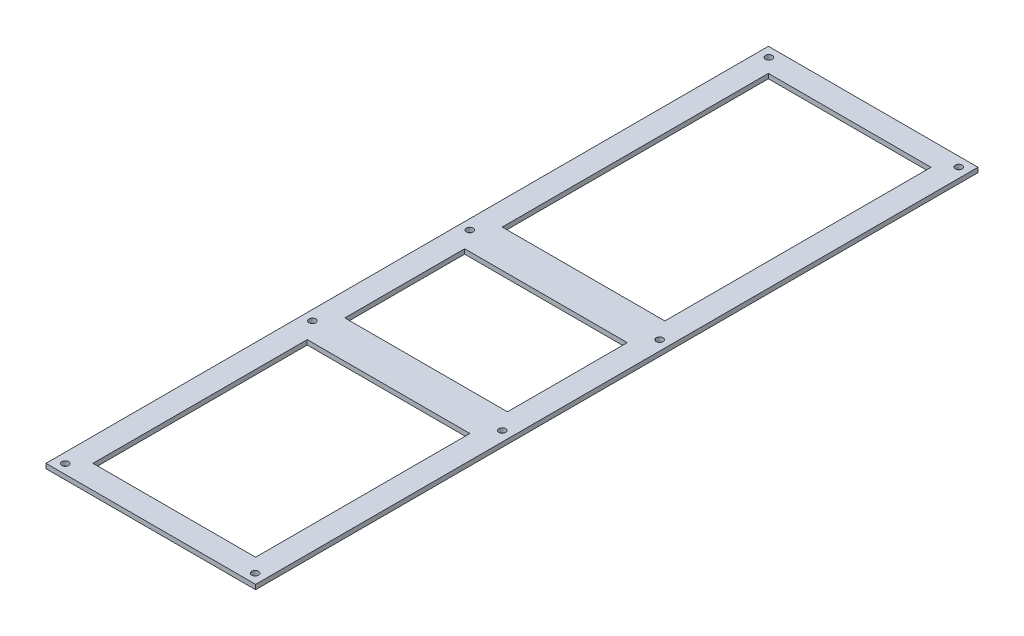
from build123d import *

# Parameters (mm, degrees)
SKETCH1_W              = 89.225
SKETCH1_H              = 307.5
SKETCH1_W_2            = 69.225
SKETCH1_H_2            = 51
BOSS_EXTRUDE1_DEPTH    = 2
M2_5_CLEARANCE_HOLE6_D = 2.9


with BuildPart() as part:
    # Sketch1 → Boss-Extrude1 (new body)
    with BuildSketch(Plane(origin=(0, 0, 0), x_dir=(1, 0, 0), z_dir=(0, 1, 0))):
        with Locations((44.6125, 153.75)):
            Rectangle(SKETCH1_W, SKETCH1_H)
        Polygon((10, 10), (79.225, 10), (79.225, 21.8), (79.225, 81.2), (79.225, 101.2), (10, 101.2), (10, 81.2), (10, 21.8), align=None, mode=Mode.SUBTRACT)
        with Locations((44.6125, 142.7)):
            Rectangle(SKETCH1_W_2, SKETCH1_H_2, mode=Mode.SUBTRACT)
        Polygon((10, 297.5), (79.225, 297.5), (79.225, 283.2), (79.225, 209.2), (79.225, 184.2), (10, 184.2), (10, 209.2), (10, 283.2), align=None, mode=Mode.SUBTRACT)
    extrude(amount=BOSS_EXTRUDE1_DEPTH)

    # M2.5 Clearance Hole6 (through all)
    with Locations(Plane(origin=(0, 2, 0), x_dir=(1, 0, 0), z_dir=(0, 1, 0))):
        with Locations((85.025, 4), (4.2, 4), (4.2, 109.2), (4.2, 176.2), (4.2, 303.5), (85.025, 303.5), (85.025, 176.2), (85.025, 109.2)):
            Hole(M2_5_CLEARANCE_HOLE6_D / 2)


solid = part.part
